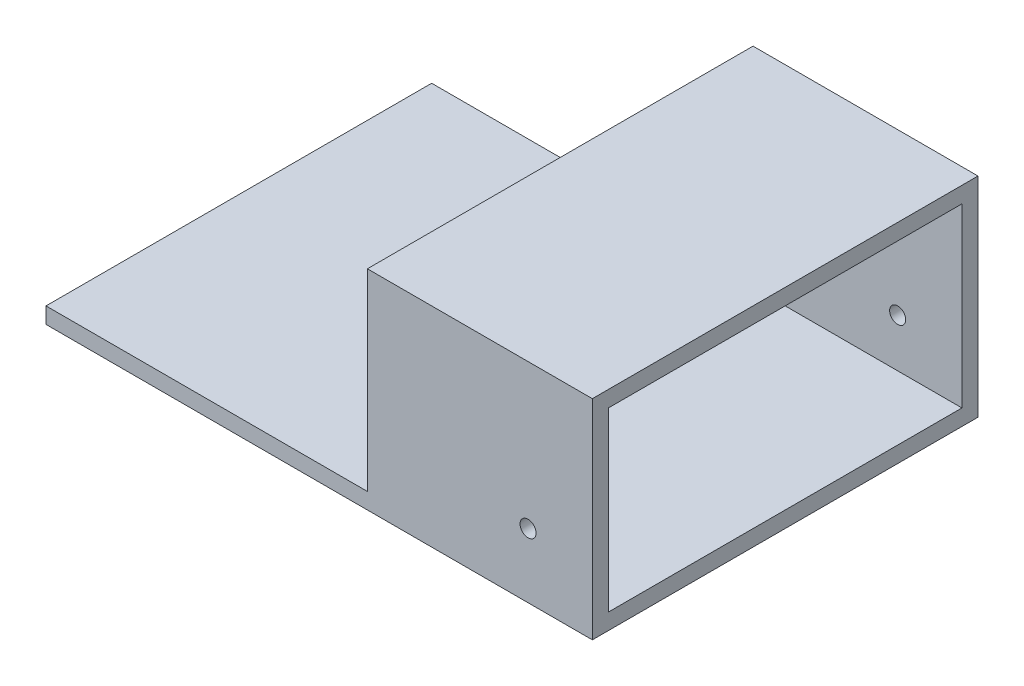
from build123d import *

# Parameters (mm, degrees)
SKETCH1_W                   = 127
SKETCH1_H                   = 152.4
BOSS_EXTRUDE1_DEPTH         = 6.35
SKETCH1_7_W                 = 88.9
SKETCH1_7_H                 = 152.4
BOSS_EXTRUDE2_DEPTH         = 82.55
SKETCH29_W                  = 139.7
SKETCH29_H                  = 69.85
CUT_EXTRUDE4_DEPTH          = 215.870338809
F_1_4_0_25_DIAMETER_HOLE2_D = 6.35


with BuildPart() as part:
    # Sketch1 → Boss-Extrude1 (new body)
    with BuildSketch(Plane(origin=(0, 0, 0), x_dir=(1, 0, 0), z_dir=(0, 1, 0))):
        with Locations((-152.4, 76.2)):
            Rectangle(SKETCH1_W, SKETCH1_H)
    extrude(amount=BOSS_EXTRUDE1_DEPTH)

    # Sketch1<7> → Boss-Extrude2 (add)
    with BuildSketch(Plane(origin=(0, 0, 0), x_dir=(1, 0, 0), z_dir=(0, 1, 0))):
        with Locations((-44.45, 76.2)):
            Rectangle(SKETCH1_7_W, SKETCH1_7_H)
    extrude(amount=BOSS_EXTRUDE2_DEPTH)

    # Sketch29 → Cut-Extrude4 (cut, through all)
    with BuildSketch(Plane.ZY.offset(88.9)):
        with Locations((-76.2, 41.275)):
            Rectangle(SKETCH29_W, SKETCH29_H)
    extrude(amount=-CUT_EXTRUDE4_DEPTH, mode=Mode.SUBTRACT)

    # 1/4 (0.25) Diameter Hole2 (through all)
    with Locations(Plane(origin=(0, 0, -152.4), x_dir=(-1, 0, 0), z_dir=(0, 0, -1))):
        with Locations((25.4, 25.4)):
            Hole(F_1_4_0_25_DIAMETER_HOLE2_D / 2)


solid = part.part
